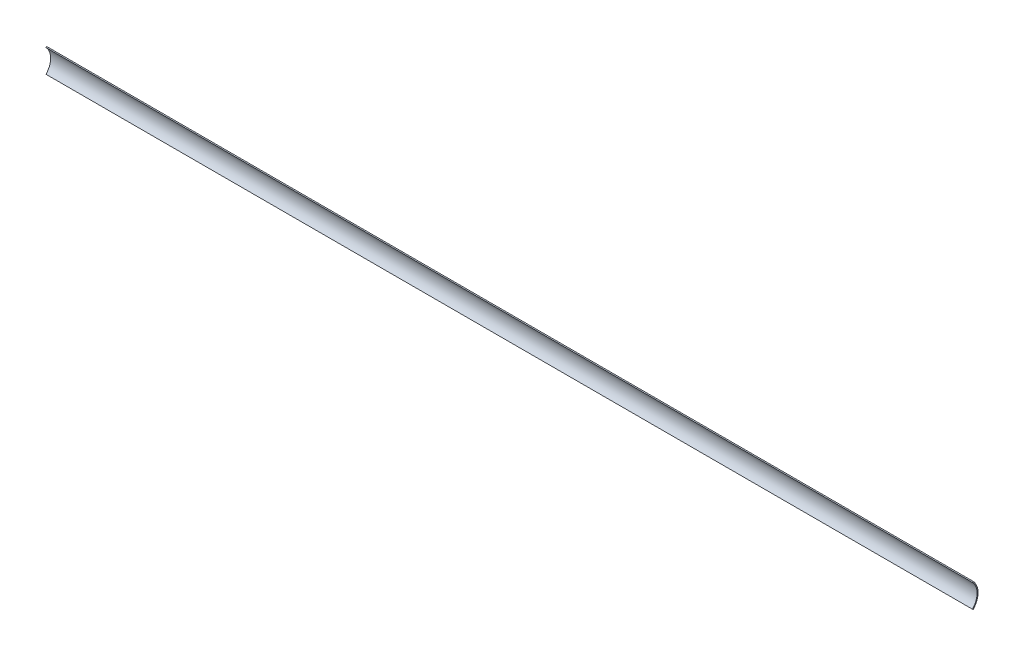
from build123d import *

# Parameters (mm, degrees)
EXTRUDE_THIN1_DEPTH = 200


with BuildPart() as part:
    # Sketch1 → Extrude-Thin1 (new body)
    with BuildSketch(Plane.YZ):
        with BuildLine():
            ThreePointArc((0, 1), (2.5, 0), (5, 1))
            Line((5, 1), (5.137931034, 0.855172414))
            ThreePointArc((5.137931034, 0.855172414), (2.5, -0.2), (-0.137931034, 0.855172414))
            Line((-0.137931034, 0.855172414), (0, 1))
        make_face()
    extrude(amount=EXTRUDE_THIN1_DEPTH)


solid = part.part
